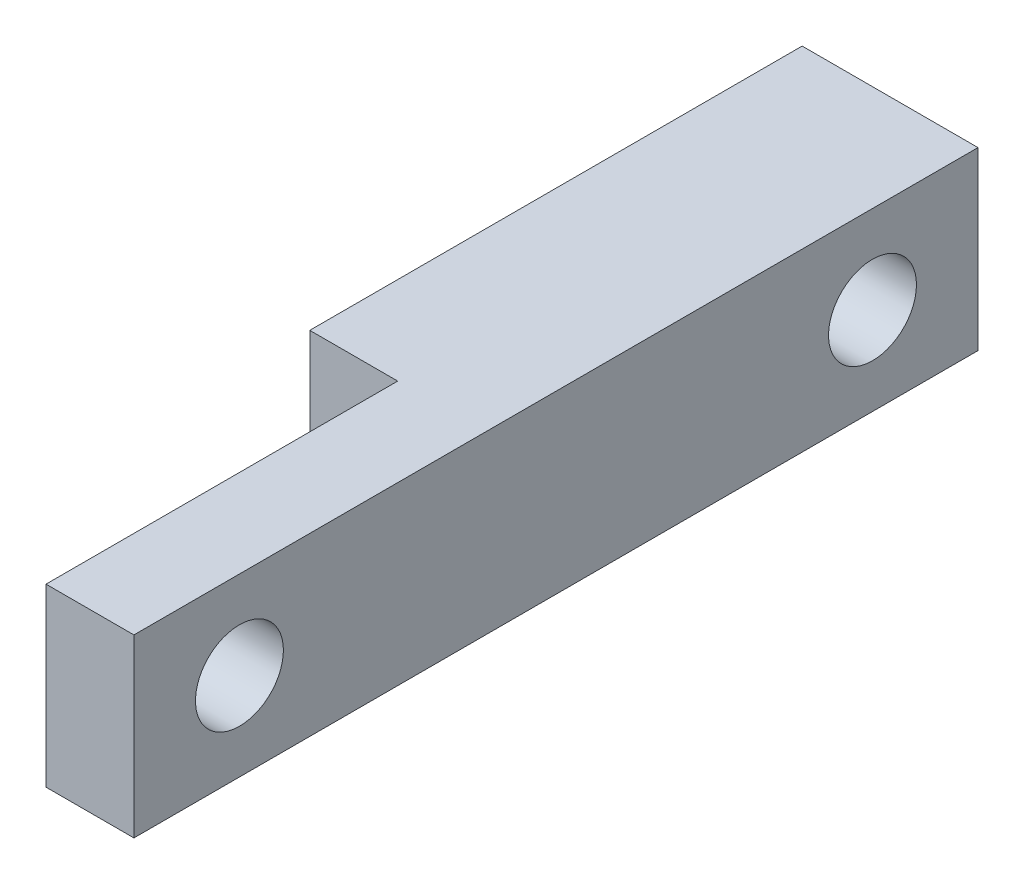
from build123d import *

# Parameters (mm, degrees)
SKETCH1_W                        = 30.48
SKETCH1_H                        = 6.35
BOSS_EXTRUDE1_DEPTH              = 6.35
F_1_8_0_125_DIAMETER_HOLE1_D     = 3.175
F_1_8_0_125_DIAMETER_HOLE1_DEPTH = 70.104
F_1_8_0_125_DIAMETER_HOLE1_TIP   = 0.953866233
SKETCH4_W                        = 12.7
SKETCH4_H                        = 6.35
CUT_EXTRUDE1_DEPTH               = 3.175
F_1_8_0_125_DIAMETER_HOLE2_D     = 3.175
F_1_8_0_125_DIAMETER_HOLE2_DEPTH = 70.104
F_1_8_0_125_DIAMETER_HOLE2_TIP   = 0.953866233


with BuildPart() as part:
    # Sketch1 → Boss-Extrude1 (new body)
    with BuildSketch(Plane(origin=(0, 0, 0), x_dir=(0, 0, -1), z_dir=(1, 0, 0))):
        with Locations((15.24, 3.175)):
            Rectangle(SKETCH1_W, SKETCH1_H)
    extrude(amount=BOSS_EXTRUDE1_DEPTH)

    # 1/8 (0.125) Diameter Hole1
    with Locations(Plane(origin=(6.35, 0, 0), x_dir=(0, 0, -1), z_dir=(1, 0, 0))):
        with Locations((3.81, 3.175)):
            Hole(F_1_8_0_125_DIAMETER_HOLE1_D / 2, depth=F_1_8_0_125_DIAMETER_HOLE1_DEPTH)
            with Locations((0, 0, -(F_1_8_0_125_DIAMETER_HOLE1_DEPTH + F_1_8_0_125_DIAMETER_HOLE1_TIP / 2))):  # 118° drill point
                Cone(0, F_1_8_0_125_DIAMETER_HOLE1_D / 2, F_1_8_0_125_DIAMETER_HOLE1_TIP, mode=Mode.SUBTRACT)

    # Sketch4 → Cut-Extrude1 (cut)
    with BuildSketch(Plane.ZY):
        with Locations((-6.35, 3.175)):
            Rectangle(SKETCH4_W, SKETCH4_H)
    extrude(amount=-CUT_EXTRUDE1_DEPTH, mode=Mode.SUBTRACT)

    # 1/8 (0.125) Diameter Hole2
    with Locations(Plane(origin=(6.35, 0, 0), x_dir=(0, 0, -1), z_dir=(1, 0, 0))):
        with Locations((26.67, 3.175), (33.02, 3.175)):
            Hole(F_1_8_0_125_DIAMETER_HOLE2_D / 2, depth=F_1_8_0_125_DIAMETER_HOLE2_DEPTH)
            with Locations((0, 0, -(F_1_8_0_125_DIAMETER_HOLE2_DEPTH + F_1_8_0_125_DIAMETER_HOLE2_TIP / 2))):  # 118° drill point
                Cone(0, F_1_8_0_125_DIAMETER_HOLE2_D / 2, F_1_8_0_125_DIAMETER_HOLE2_TIP, mode=Mode.SUBTRACT)


solid = part.part
